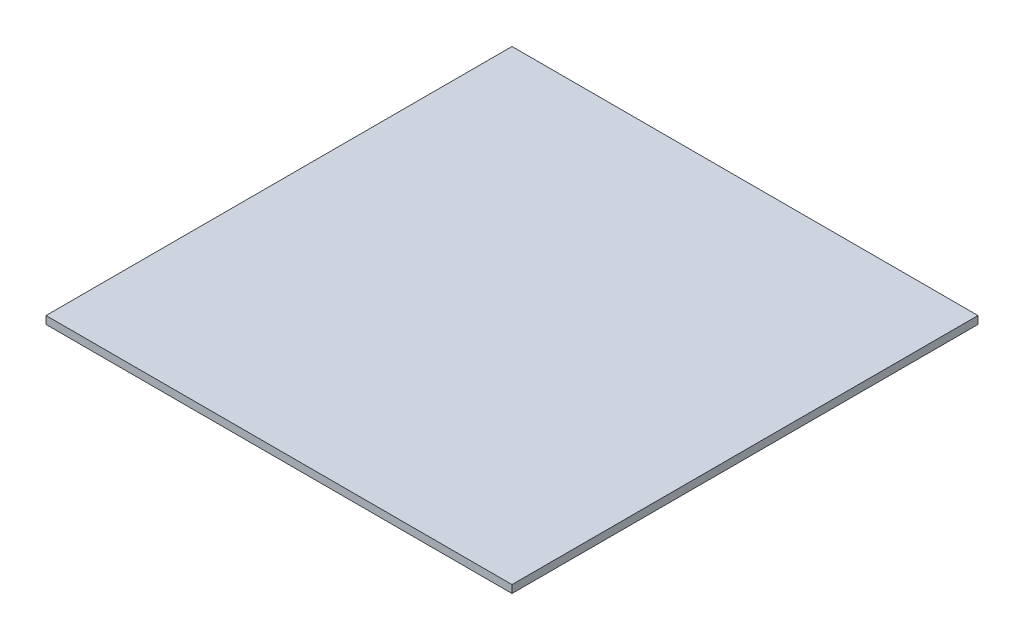
from build123d import *

# Parameters (mm, degrees)
SKETCH1_W           = 152.4
SKETCH1_H           = 152.4
BOSS_EXTRUDE1_DEPTH = 2.54


with BuildPart() as part:
    # Sketch1 → Boss-Extrude1 (new body)
    with BuildSketch(Plane(origin=(0, 0, 0), x_dir=(1, 0, 0), z_dir=(0, 1, 0))):
        with Locations((76.2, 76.2)):
            Rectangle(SKETCH1_W, SKETCH1_H)
    extrude(amount=BOSS_EXTRUDE1_DEPTH)


solid = part.part
